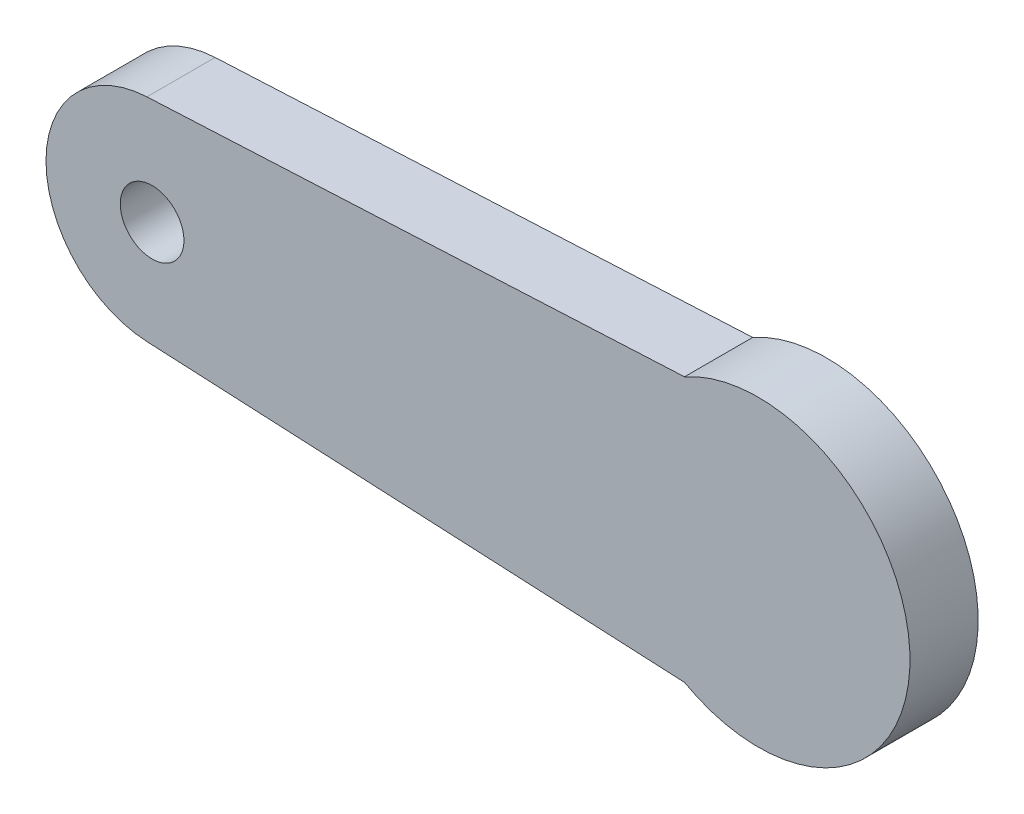
from build123d import *

# Parameters (mm, degrees)
BOSS_EXTRUDE1_DEPTH = 2
BOSS_EXTRUDE2_DEPTH = 4
CUT_EXTRUDE3_DEPTH  = 3.15
BOSS_EXTRUDE3_START = 0.5
BOSS_EXTRUDE3_DEPTH = 0.5
SKETCH8_R           = 2.1
CUT_EXTRUDE4_DEPTH  = 32.941352507


with BuildPart() as part:
    # Sketch1 → Boss-Extrude1 (new, symmetric)
    with BuildSketch(Plane.XY):
        with BuildLine():
            Line((16, 3), (-16, 3))
            ThreePointArc((-16, 3), (-25, 0), (-16, -3))
            Line((-16, -3), (16, -3))
            ThreePointArc((16, -3), (25, 0), (16, 3))
        make_face()
    extrude(amount=BOSS_EXTRUDE1_DEPTH, both=True)

    # Sketch3 → Boss-Extrude2 (add)
    with BuildSketch(Plane.XY.offset(2)):
        with BuildLine():
            ThreePointArc((-20.342845142, 6.991599045), (-27, 0), (-20.342845142, -6.991599045))
            Line((-20.342845142, -6.991599045), (15.124207365, -8.73078726))
            ThreePointArc((15.124207365, -8.73078726), (30, 0), (15.124207365, 8.73078726))
            Line((15.124207365, 8.73078726), (-20.342845142, 6.991599045))
        make_face()
        with BuildLine():
            ThreePointArc((-16, -3), (-25, 0), (-16, 3))
            Line((-16, 3), (16, 3))
            ThreePointArc((16, 3), (25, 0), (16, -3))
            Line((16, -3), (-16, -3))
        make_face(mode=Mode.SUBTRACT)
    extrude(amount=-BOSS_EXTRUDE2_DEPTH)

    # Sketch6 → Cut-Extrude3 (cut)
    with BuildSketch(Plane(origin=(0, 0, -2), x_dir=(-1, 0, 0), z_dir=(0, 0, -1))):
        with BuildLine():
            Line((-8, -3.5), (4, -3.5))
            ThreePointArc((4, -3.5), (7.5, 0), (4, 3.5))
            Line((4, 3.5), (-8, 3.5))
            ThreePointArc((-8, 3.5), (-12.021685318, 4.137122098), (-15.649519503, 5.986093838))
            ThreePointArc((-15.649519503, 5.986093838), (-27.4, 0), (-15.649519503, -5.986093838))
            ThreePointArc((-15.649519503, -5.986093838), (-12.021685318, -4.137122098), (-8, -3.5))
        make_face()
    extrude(amount=-CUT_EXTRUDE3_DEPTH, mode=Mode.SUBTRACT)

    # Sketch7 → Boss-Extrude3 (add)
    with BuildSketch(Plane.XY.offset(2).offset(BOSS_EXTRUDE3_START)):
        with BuildLine():
            ThreePointArc((-20.342845142, 6.991599045), (-27, 0), (-20.342845142, -6.991599045))
            ThreePointArc((-20.342845142, -6.991599045), (-15.172988295, -5.0695126), (-13, 0))
            ThreePointArc((-13, 0), (-15.172988295, 5.0695126), (-20.342845142, 6.991599045))
        make_face()
        with BuildLine():
            ThreePointArc((-13, 0), (-15.172988295, -5.0695126), (-20.342845142, -6.991599045))
            Line((-20.342845142, -6.991599045), (15.124207365, -8.73078726))
            ThreePointArc((15.124207365, -8.73078726), (10, 0), (15.124207365, 8.73078726))
            Line((15.124207365, 8.73078726), (-20.342845142, 6.991599045))
            ThreePointArc((-20.342845142, 6.991599045), (-15.172988295, 5.0695126), (-13, 0))
        make_face()
        with BuildLine():
            ThreePointArc((15.124207365, 8.73078726), (10, 0), (15.124207365, -8.73078726))
            ThreePointArc((15.124207365, -8.73078726), (25.061722713, -8.624323926), (30, 0))
            ThreePointArc((30, 0), (25.061722713, 8.624323926), (15.124207365, 8.73078726))
        make_face()
    extrude(amount=-BOSS_EXTRUDE3_DEPTH)

    # Sketch8 → Cut-Extrude4 (cut, through all)
    with BuildSketch(Plane(origin=(0, 0, -2), x_dir=(-1, 0, 0), z_dir=(0, 0, -1))):
        with Locations((20, 0)):
            Circle(SKETCH8_R)
    extrude(amount=-CUT_EXTRUDE4_DEPTH, mode=Mode.SUBTRACT)


solid = part.part
